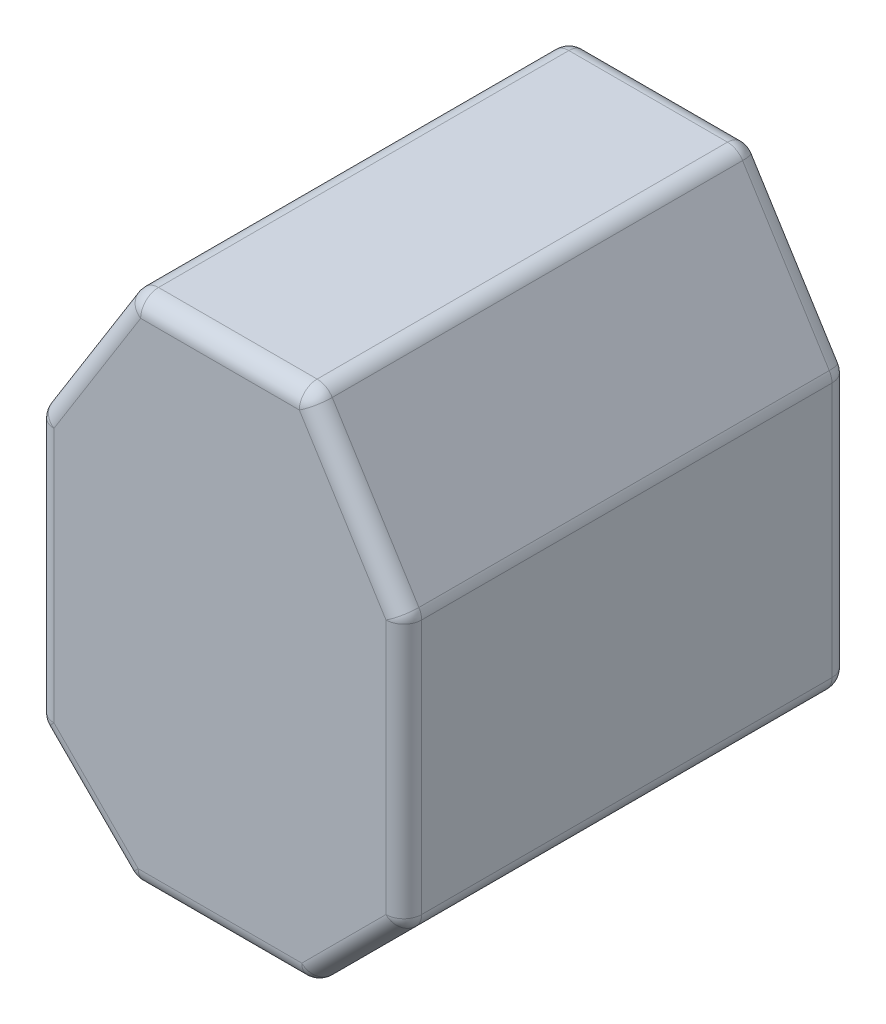
from build123d import *

# Parameters (mm, degrees)
BOSS_EXTRUDE1_DEPTH = 50
FILLET1_R           = 2


with BuildPart() as part:
    # Sketch1 → Boss-Extrude1 (new body)
    with BuildSketch(Plane.XY):
        Polygon((0, 0), (-20, 0), (-30.606601718, -16.955824958), (-30.606601718, -46.955824958), (-20, -57.562426676), (0, -57.562426676), (10.606601718, -46.955824958), (10.606601718, -16.955824958), align=None)
    extrude(amount=BOSS_EXTRUDE1_DEPTH)

    # Fillet1
    fillet1_edges = [part.edges().sort_by_distance(p)[0] for p in [
        (-30.606601718, -31.955824958, 0),
        (-25.303300859, -8.477912479, 0),
        (-10, 0, 0),
        (5.303300859, -8.477912479, 0),
        (-25.303300859, -8.477912479, 50),
        (10.606601718, -16.955824958, 25),
        (10.606601718, -46.955824958, 25),
        (0, -57.562426676, 25),
        (-20, -57.562426676, 25),
        (-30.606601718, -46.955824958, 25),
        (-30.606601718, -16.955824958, 25),
        (-20, 0, 25),
        (0, 0, 25),
        (-30.606601718, -31.955824958, 50),
        (-25.303300859, -52.259125817, 50),
        (-10, -57.562426676, 50),
        (5.303300859, -52.259125817, 50),
        (10.606601718, -31.955824958, 50),
        (5.303300859, -8.477912479, 50),
        (10.606601718, -31.955824958, 0),
        (-10, 0, 50),
        (5.303300859, -52.259125817, 0),
        (-10, -57.562426676, 0),
        (-25.303300859, -52.259125817, 0),
    ]]
    fillet(fillet1_edges, radius=FILLET1_R)


solid = part.part
